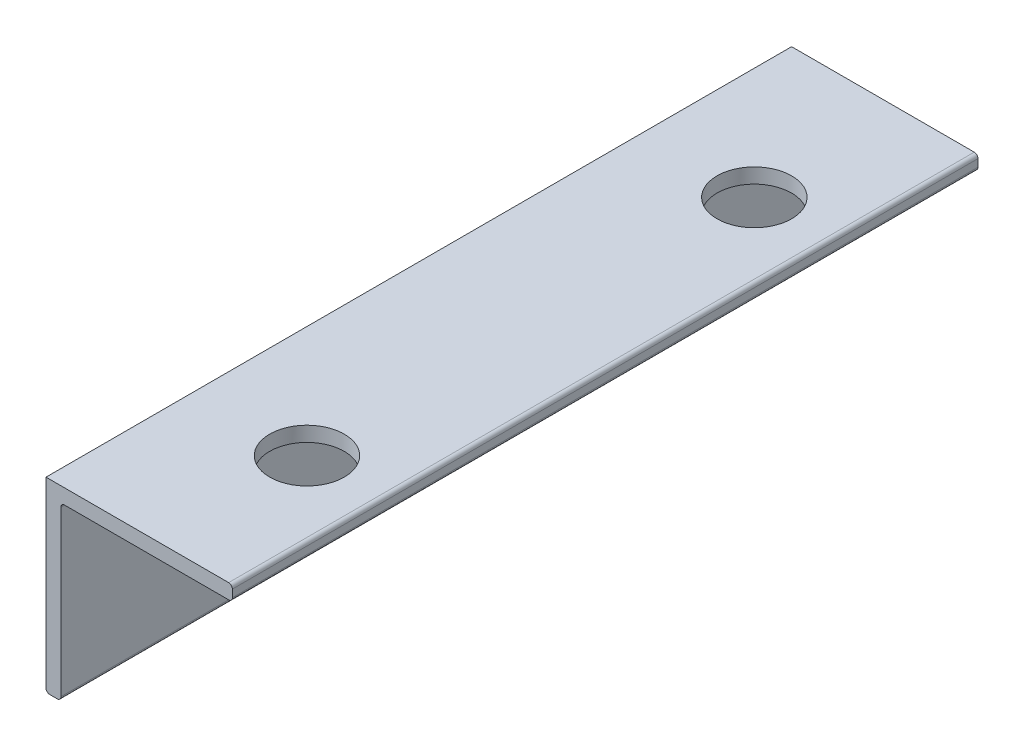
from build123d import *

# Parameters (mm, degrees)
EXTRUDE_1_DEPTH     = 100
CUT_EXTRUDE_1_REACH = 106.163
SKETCH_2_R          = 5


with BuildPart() as part:
    # Эскиз1 → Бобышка-Вытянуть1 (new body)
    with BuildSketch(Plane.XY):
        with BuildLine():
            Line((10, 14.5), (10, 13.5))
            ThreePointArc((10, 13.5), (9.853553391, 13.146446609), (9.5, 13))
            Line((9.5, 13), (-12.5, 13))
            ThreePointArc((-12.5, 13), (-12.853553391, 12.853553391), (-13, 12.5))
            Line((-13, 12.5), (-13, -9.5))
            ThreePointArc((-13, -9.5), (-13.146446609, -9.853553391), (-13.5, -10))
            Line((-13.5, -10), (-14.5, -10))
            ThreePointArc((-14.5, -10), (-14.853553391, -9.853553391), (-15, -9.5))
            Line((-15, -9.5), (-15, 15))
            Line((-15, 15), (9.5, 15))
            ThreePointArc((9.5, 15), (9.853553391, 14.853553391), (10, 14.5))
        make_face()
    extrude(amount=EXTRUDE_1_DEPTH)

    # Эскиз2 → Вырез-Вытянуть1 (cut, up to next)
    with BuildSketch(Plane(origin=(0, 15, 0), x_dir=(1, 0, 0), z_dir=(0, 1, 0)), mode=Mode.PRIVATE) as cut_extrude_1_sk1:
        with Locations(Location((0, -80, 0), (0, 0, 270))):
            Circle(SKETCH_2_R)
    cut_extrude_1_tool1 = extrude(cut_extrude_1_sk1.sketch, amount=-CUT_EXTRUDE_1_REACH, mode=Mode.PRIVATE) & part.part
    # Эскиз2 → Вырез-Вытянуть1 (cut, up to next)
    with BuildSketch(Plane(origin=(0, 15, 0), x_dir=(1, 0, 0), z_dir=(0, 1, 0)), mode=Mode.PRIVATE) as cut_extrude_1_sk2:
        with Locations(Location((0, -20, 0), (0, 0, 270))):
            Circle(SKETCH_2_R)
    cut_extrude_1_tool2 = extrude(cut_extrude_1_sk2.sketch, amount=-CUT_EXTRUDE_1_REACH, mode=Mode.PRIVATE) & part.part
    add(cut_extrude_1_tool1.solids().sort_by_distance((0, 15, 80))[0], mode=Mode.SUBTRACT)
    add(cut_extrude_1_tool2.solids().sort_by_distance((0, 15, 20))[0], mode=Mode.SUBTRACT)


solid = part.part
